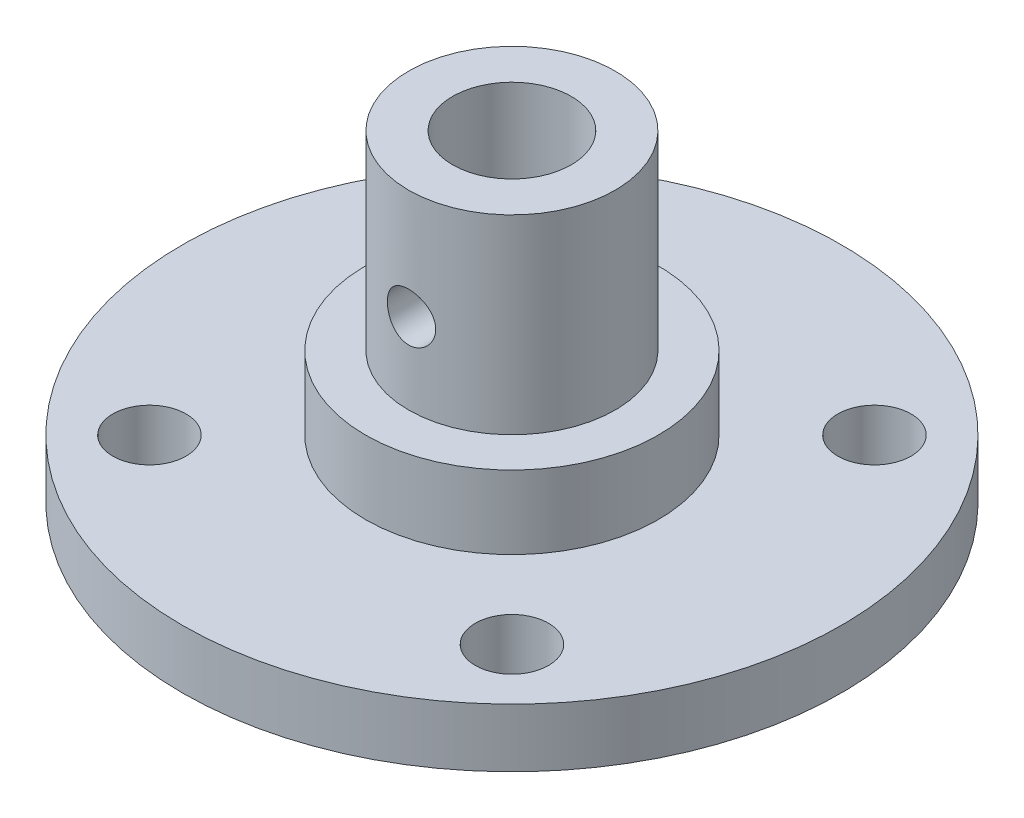
from build123d import *

# Parameters (mm, degrees)
SKETCH1_R           = 22.5
SKETCH1_R_2         = 2.5
BOSS_EXTRUDE1_DEPTH = 4
SKETCH2_R           = 7.05
SKETCH2_R_2         = 4.05
BOSS_EXTRUDE2_DEPTH = 18
SKETCH3_R           = 1.65
CUT_EXTRUDE1_DEPTH  = 9
SKETCH4_R           = 10
SKETCH4_R_2         = 7
BOSS_EXTRUDE3_DEPTH = 5


with BuildPart() as part:
    # Sketch1 → Boss-Extrude1 (new body)
    with BuildSketch(Plane(origin=(0, 0, 0), x_dir=(1, 0, 0), z_dir=(0, 1, 0))):
        with Locations(Location((0, 0, 0), (0, 0, 270))):
            Circle(SKETCH1_R)
        with Locations(Location((-12.374368671, 12.374368671, 0), (0, 0, 270))):
            Circle(SKETCH1_R_2, mode=Mode.SUBTRACT)
        with Locations(Location((12.374368671, 12.374368671, 0), (0, 0, 270))):
            Circle(SKETCH1_R_2, mode=Mode.SUBTRACT)
        with Locations(Location((12.374368671, -12.374368671, 0), (0, 0, 270))):
            Circle(SKETCH1_R_2, mode=Mode.SUBTRACT)
        with Locations(Location((-12.374368671, -12.374368671, 0), (0, 0, 270))):
            Circle(SKETCH1_R_2, mode=Mode.SUBTRACT)
    extrude(amount=BOSS_EXTRUDE1_DEPTH)

    # Sketch2 → Boss-Extrude2 (add)
    with BuildSketch(Plane(origin=(0, 4, 0), x_dir=(1, 0, 0), z_dir=(0, 1, 0))):
        with Locations(Location((0, 0, 0), (0, 0, 270))):
            Circle(SKETCH2_R)
        with Locations(Location((0, 0, 0), (0, 0, 270))):
            Circle(SKETCH2_R_2, mode=Mode.SUBTRACT)
    extrude(amount=BOSS_EXTRUDE2_DEPTH)

    # Sketch3 → Cut-Extrude1 (cut, symmetric)
    with BuildSketch(Plane.XY):
        with Locations((0, 14.5)):
            Circle(SKETCH3_R)
    extrude(amount=CUT_EXTRUDE1_DEPTH, both=True, mode=Mode.SUBTRACT)

    # Sketch4 → Boss-Extrude3 (add)
    with BuildSketch(Plane(origin=(0, 4, 0), x_dir=(1, 0, 0), z_dir=(0, 1, 0))):
        with Locations(Location((0, 0, 0), (0, 0, 270))):
            Circle(SKETCH4_R)
        Circle(SKETCH4_R_2, mode=Mode.SUBTRACT)
    extrude(amount=BOSS_EXTRUDE3_DEPTH)


solid = part.part
